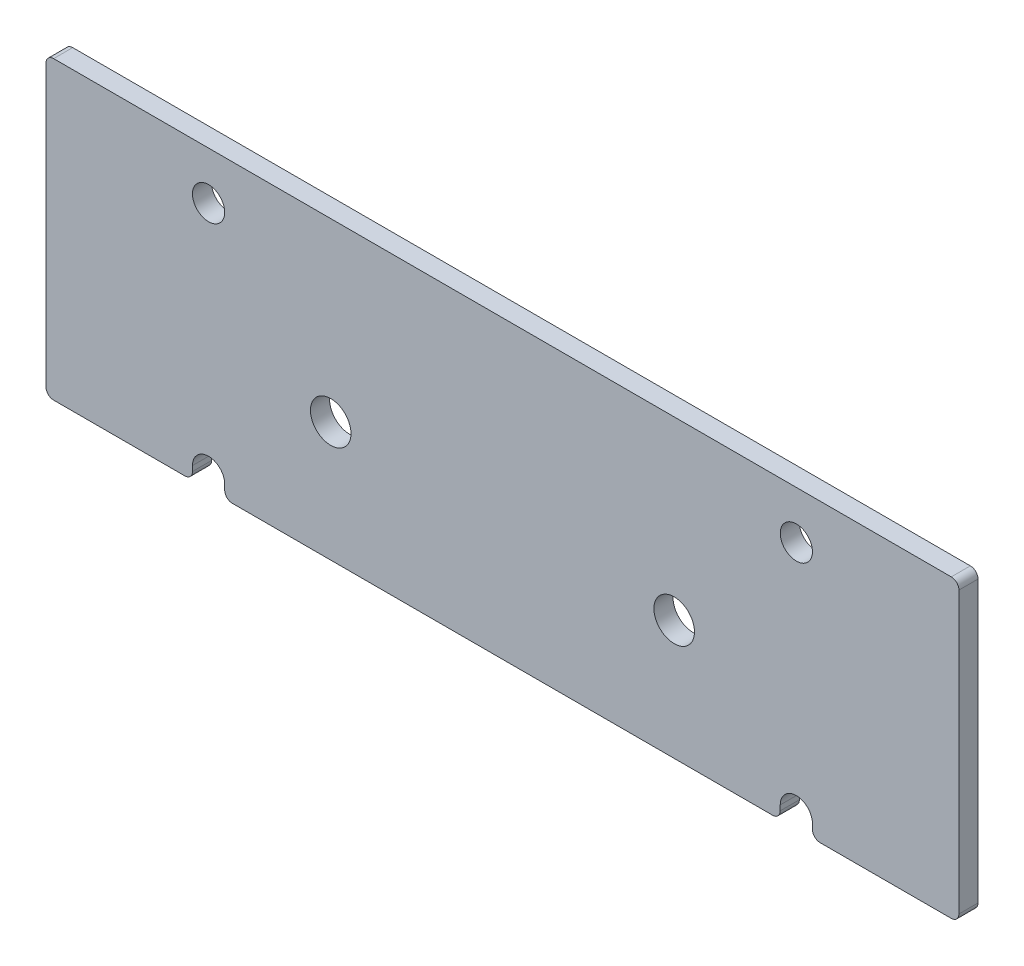
from build123d import *

# Parameters (mm, degrees)
BOSS_EXTRUDE1_DEPTH              = 6.35
CUT_EXTRUDE3_DEPTH               = 221.472033966
F_27_64_0_42188_DIAMETER_HOLE1_D = 10.715752
FILLET1_R                        = 2.54
F_1_2_CLEARANCE_HOLE1_D          = 13.49248
SKETCH7_W                        = 303.784
SKETCH7_H                        = 55.43328257
CUT_EXTRUDE1_DEPTH               = 200.030230178
CUT_EXTRUDE2_DEPTH               = 200.030230178
FILLET2_R                        = 2.54


with BuildPart() as part:
    # Sketch1 → Boss-Extrude1 (new body)
    with BuildSketch(Plane.XY):
        with BuildLine():
            Line((-179.07, -25.4), (-179.07, 128.45828257))
            Line((-179.07, 128.45828257), (179.07, 128.45828257))
            Line((179.07, 128.45828257), (179.07, -25.4))
            Line((179.07, -25.4), (153.67, -25.4))
            Line((153.67, -25.4), (153.67, -1.27))
            ThreePointArc((153.67, -1.27), (127, 25.4), (100.33, -1.27))
            Line((100.33, -1.27), (100.33, -25.4))
            Line((100.33, -25.4), (-100.33, -25.4))
            Line((-100.33, -25.4), (-100.33, -1.27))
            ThreePointArc((-100.33, -1.27), (-127, 25.4), (-153.67, -1.27))
            Line((-153.67, -1.27), (-153.67, -25.4))
            Line((-153.67, -25.4), (-179.07, -25.4))
        make_face()
    extrude(amount=BOSS_EXTRUDE1_DEPTH)

    # Sketch9 → Cut-Extrude3 (cut, through all)
    with BuildSketch(Plane.XY.offset(6.35)):
        with BuildLine():
            Line((-151.892, 128.45828257), (-151.892, 8.304823027))
            ThreePointArc((-151.892, 8.304823027), (-153.22173278, 3.599253536), (-153.67, -1.27))
            Line((-153.67, -1.27), (-153.67, -25.4))
            Line((-153.67, -25.4), (-179.07, -25.4))
            Line((-179.07, -25.4), (-179.07, 128.45828257))
            Line((-179.07, 128.45828257), (-151.892, 128.45828257))
        make_face()
        with BuildLine():
            Line((153.67, -25.4), (153.67, -1.27))
            ThreePointArc((153.67, -1.27), (153.22173278, 3.599253536), (151.892, 8.304823027))
            Line((151.892, 8.304823027), (151.892, 128.45828257))
            Line((151.892, 128.45828257), (179.07, 128.45828257))
            Line((179.07, 128.45828257), (179.07, -25.4))
            Line((179.07, -25.4), (153.67, -25.4))
        make_face()
    extrude(amount=-CUT_EXTRUDE3_DEPTH, mode=Mode.SUBTRACT)

    # 27/64 (0.42188) Diameter Hole1 (through all)
    with Locations(Plane.XY.offset(6.35)):
        with Locations((-97.79, 34.29), (-97.79, 112.58328257), (97.79, 34.29), (97.79, 112.58328257)):
            Hole(F_27_64_0_42188_DIAMETER_HOLE1_D / 2)

    # Fillet1
    fillet1_edges = [part.edges().sort_by_distance(p)[0] for p in [
        (100.33, -25.4, 3.175),
        (-100.33, -25.4, 3.175),
        (-151.892, 128.45828257, 3.175),
        (-151.892, 8.304823027, 3.175),
        (151.892, 8.304823027, 3.175),
        (151.892, 128.45828257, 3.175),
    ]]
    fillet(fillet1_edges, radius=FILLET1_R)

    # 1/2 Clearance Hole1 (through all)
    with Locations(Plane.XY.offset(6.35)):
        with Locations((57.15, 69.85), (-57.15, 69.85)):
            Hole(F_1_2_CLEARANCE_HOLE1_D / 2)

    # Sketch7 → Cut-Extrude1 (cut, through all)
    with BuildSketch(Plane.XY.offset(6.35)):
        with Locations((0, 2.316641285)):
            Rectangle(SKETCH7_W, SKETCH7_H)
    extrude(amount=-CUT_EXTRUDE1_DEPTH, mode=Mode.SUBTRACT)

    # Sketch8 → Cut-Extrude2 (cut, through all)
    with BuildSketch(Plane.XY.offset(6.35)):
        Polygon((-94.536203455, 30.03328257), (-92.432124, 30.03328257), (-92.432124, 34.29), align=None)
        Polygon((-103.147876, 34.29), (-103.147876, 30.03328257), (-101.043796545, 30.03328257), align=None)
        Polygon((101.043796545, 30.03328257), (103.147876, 30.03328257), (103.147876, 34.29), align=None)
        Polygon((92.432124, 34.29), (92.432124, 30.03328257), (94.536203455, 30.03328257), align=None)
    extrude(amount=-CUT_EXTRUDE2_DEPTH, mode=Mode.SUBTRACT)

    # Fillet2
    fillet2_edges = [part.edges().sort_by_distance(p)[0] for p in [
        (-151.892, 30.03328257, 3.175),
        (151.892, 30.03328257, 3.175),
        (-103.147876, 30.03328257, 3.175),
        (103.147876, 30.03328257, 3.175),
        (92.432124, 30.03328257, 3.175),
        (-92.432124, 30.03328257, 3.175),
    ]]
    fillet(fillet2_edges, radius=FILLET2_R)


solid = part.part
